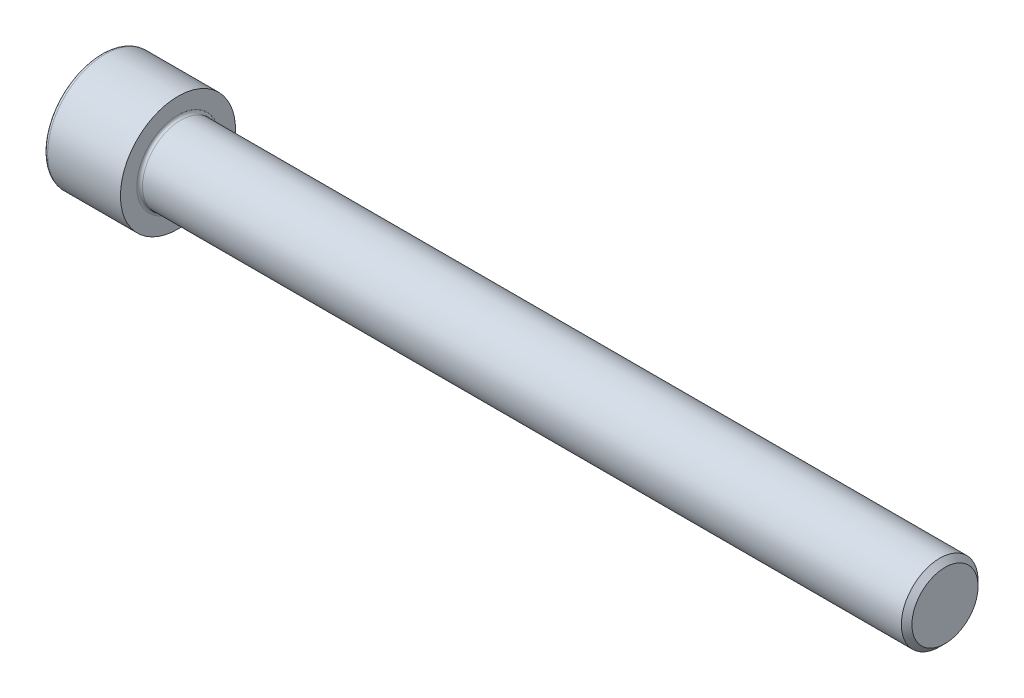
from build123d import *

# Parameters (mm, degrees)
FILLET1_R   = 0.6
FILLET2_R   = 0.8
HEX_2_DEPTH = 8


with BuildPart() as part:
    # BodySke → Base-Revolve (revolve)
    with BuildSketch(Plane.XY, mode=Mode.PRIVATE) as base_revolve_sk:
        Polygon((0, 0), (0, 12), (16, 12), (16, 8), (174.8985, 8), (176, 6.8985), (176, 0), align=None)
    revolve(base_revolve_sk.sketch.rotate(Axis((-31.75, 0, 0), (1, 0, 0)), 90), axis=Axis((-31.75, 0, 0), (1, 0, 0)))

    # Fillet1
    fillet1_edges = [part.edges().sort_by_distance(p)[0] for p in [
        (16, 0, -8),
    ]]
    fillet(fillet1_edges, radius=FILLET1_R)

    # Fillet2
    fillet2_edges = [part.edges().sort_by_distance(p)[0] for p in [
        (0, 0, -12),
    ]]
    fillet(fillet2_edges, radius=FILLET2_R)

    # Sketch2 → Hex-PreBroach (revolve, cut)
    with BuildSketch(Plane.XY, mode=Mode.PRIVATE) as hex_prebroach_sk:
        Polygon((0, 7.071), (8, 7.071), (12.082443753, 0), (0, 0), align=None)
    revolve(hex_prebroach_sk.sketch.rotate(Axis((0, 0, 0), (1, 0, 0)), 90), axis=Axis((0, 0, 0), (1, 0, 0)), mode=Mode.SUBTRACT)

    # Sketch3 → Hex 2 (cut)
    with BuildSketch(Plane(origin=(0, 0, 0), x_dir=(0, 0.500000000000001, 0.866025403784438), z_dir=(-1, 0, 0))):
        Polygon((4.082443753, 7.071), (-4.082443753, 7.071), (-8.164887507, 0), (-4.082443753, -7.071), (4.082443753, -7.071), (8.164887507, 0), align=None)
    extrude(amount=-HEX_2_DEPTH, mode=Mode.SUBTRACT)


solid = part.part
